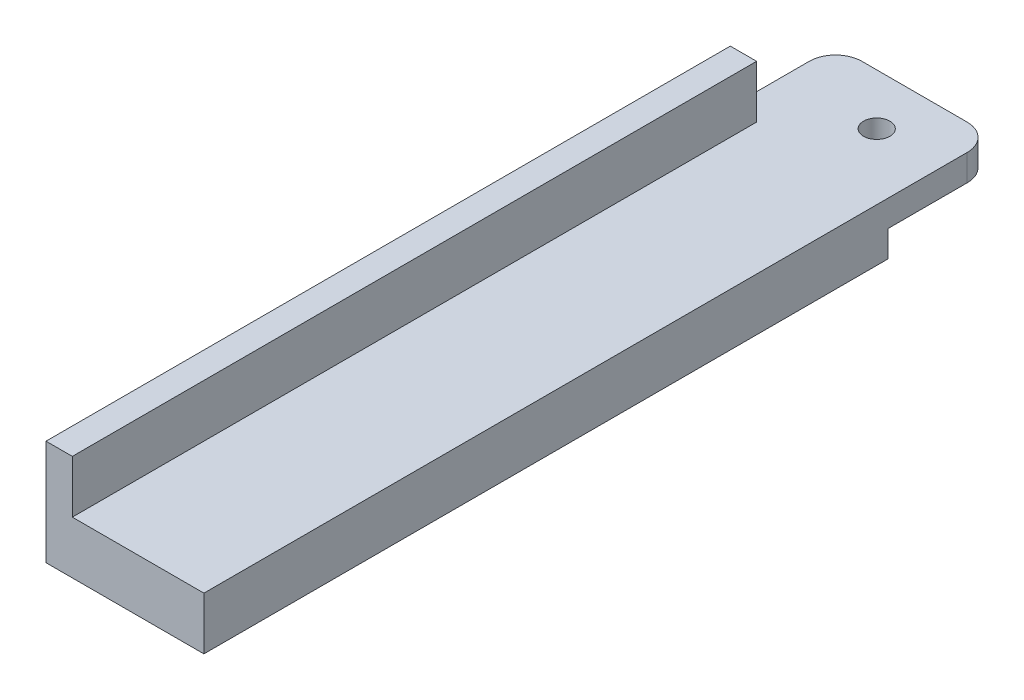
from build123d import *

# Parameters (mm, degrees)
EXTRUDE_1_DEPTH          = 300
SKETCH_2_W               = 10
SKETCH_2_H               = 20
CUT_EXTRUDE_1_DEPTH      = 40
CUT_EXTRUDE_2_DEPTH      = 307.594194335
CUT_EXTRUDE_2_DEPTH_BACK = 307.594194335
SKETCH_4_R               = 5
FILLET_1_R               = 10


with BuildPart() as part:
    # 草图1 → 凸台-拉伸1 (new body)
    with BuildSketch(Plane.XY):
        Polygon((0, 0), (0, -40), (60, -40), (60, -20), (10, -20), (10, 0), align=None)
    extrude(amount=EXTRUDE_1_DEPTH)

    # 草图2 → 切除-拉伸1 (cut)
    with BuildSketch(Plane(origin=(0, 0, 0), x_dir=(-1, 0, 0), z_dir=(0, 0, -1))):
        with Locations((-5, -10)):
            Rectangle(SKETCH_2_W, SKETCH_2_H)
        Polygon((-10, -30), (0, -30), (0, -40), (-10, -40), (-60, -40), (-60, -30), align=None)
    extrude(amount=-CUT_EXTRUDE_1_DEPTH, mode=Mode.SUBTRACT)

    # 草图4 → 切除-拉伸2 (cut, two sides: drawn at the far end of the back side and taken through both)
    with BuildSketch(Plane(origin=(0, -20, 0), x_dir=(1, 0, 0), z_dir=(0, 1, 0)).offset(-CUT_EXTRUDE_2_DEPTH_BACK)):
        with Locations(Location((35, -19.364916731, 0), (0, 0, 180))):
            Circle(SKETCH_4_R)
    extrude(amount=CUT_EXTRUDE_2_DEPTH + CUT_EXTRUDE_2_DEPTH_BACK, mode=Mode.SUBTRACT)

    # 圆角1
    fillet_1_edges = [part.edges().sort_by_distance(p)[0] for p in [
        (60, -25, 0),
        (0, -25, 0),
    ]]
    fillet(fillet_1_edges, radius=FILLET_1_R)


solid = part.part
